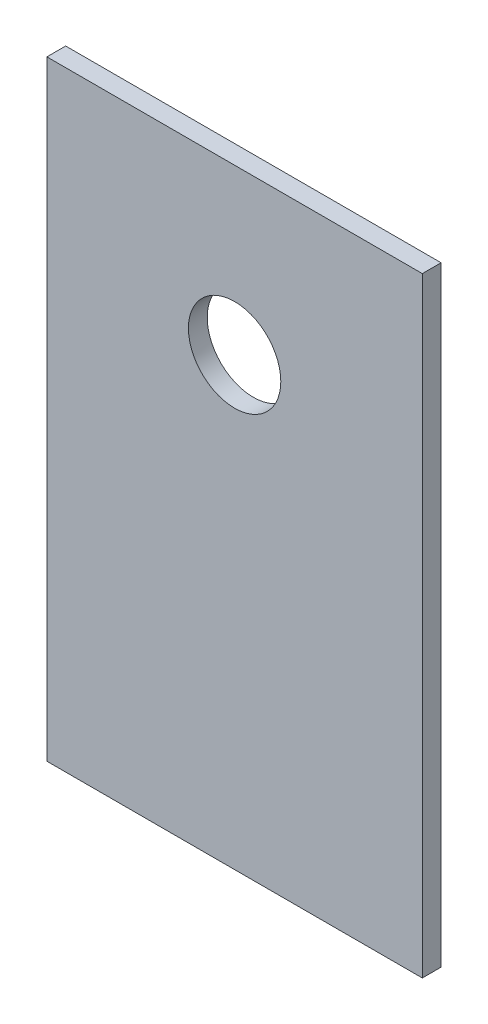
from build123d import *

# Parameters (mm, degrees)
SKETCH1_W               = 101.6
SKETCH1_H               = 165.1
BOSS_EXTRUDE1_DEPTH     = 5.08
CUT_EXTRUDE1_DEPTH      = 98.061572726
CUT_EXTRUDE1_DEPTH_BACK = 98.061572726
SKETCH3_R               = 12.500000019


with BuildPart() as part:
    # Sketch1 → Boss-Extrude1 (new body)
    with BuildSketch(Plane.XY):
        Rectangle(SKETCH1_W, SKETCH1_H)
    extrude(amount=BOSS_EXTRUDE1_DEPTH)

    # Sketch3 → Cut-Extrude1 (cut, two sides: drawn at the far end of the back side and taken through both)
    with BuildSketch(Plane.XY.offset(5.08).offset(-CUT_EXTRUDE1_DEPTH_BACK)):
        with Locations((0, 38.1)):
            Circle(SKETCH3_R)
    extrude(amount=CUT_EXTRUDE1_DEPTH + CUT_EXTRUDE1_DEPTH_BACK, mode=Mode.SUBTRACT)


solid = part.part
